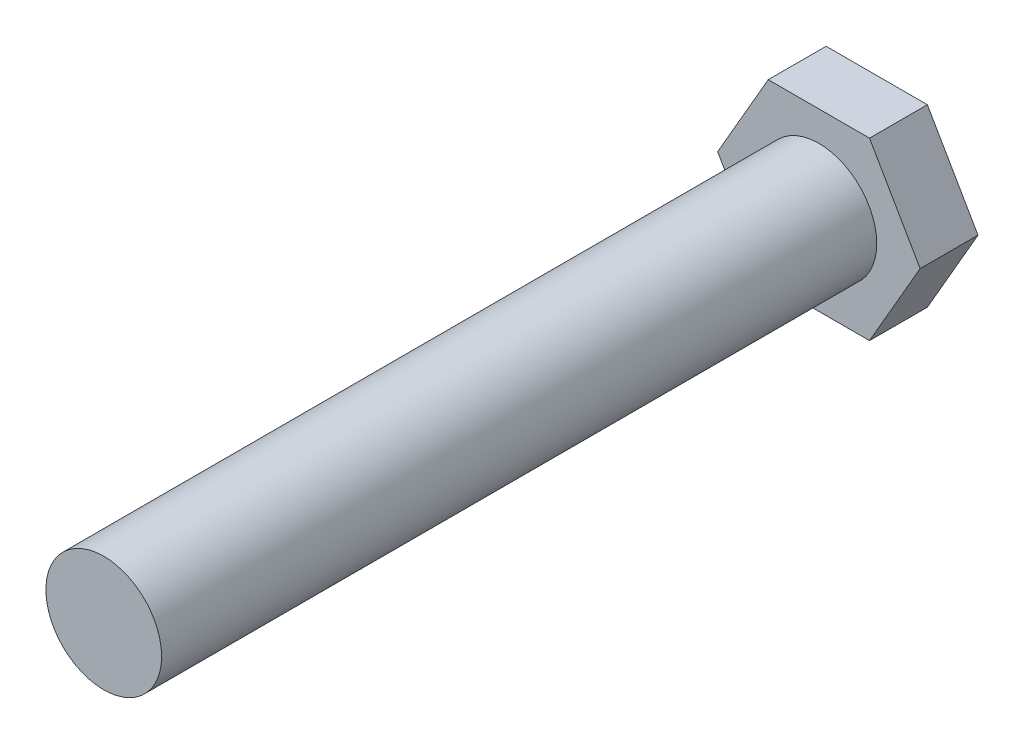
from build123d import *

# Parameters (mm, degrees)
BOSS_EXTRUDE1_DEPTH = 12.7
SKETCH2_R           = 12.7
BOSS_EXTRUDE2_DEPTH = 156.972


with BuildPart() as part:
    # Sketch1 → Boss-Extrude1 (new body)
    with BuildSketch(Plane.XY):
        Polygon((22.225, 0), (11.1125, 19.247414599), (-11.1125, 19.247414599), (-22.225, 0), (-11.1125, -19.247414599), (11.1125, -19.247414599), align=None)
    extrude(amount=BOSS_EXTRUDE1_DEPTH)

    # Sketch2 → Boss-Extrude2 (add)
    with BuildSketch(Plane.XY.offset(12.7)):
        Circle(SKETCH2_R)
    extrude(amount=BOSS_EXTRUDE2_DEPTH)


solid = part.part
